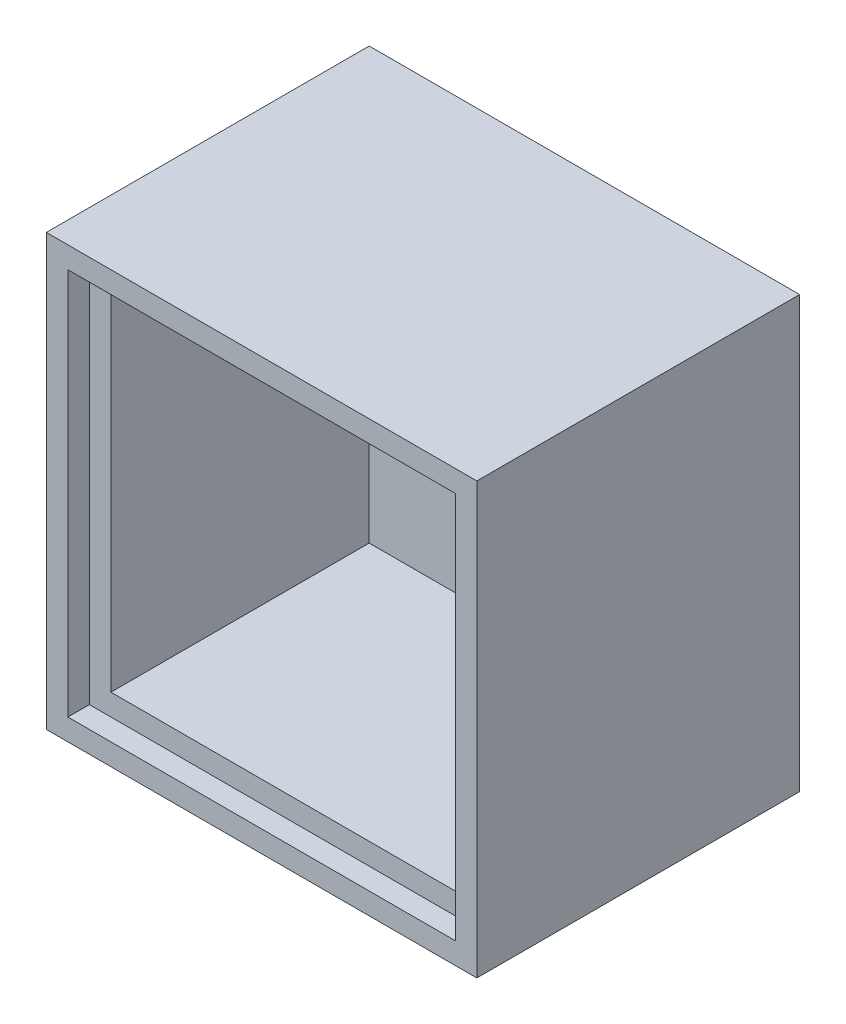
from build123d import *

# Parameters (mm, degrees)
SKETCH2_W           = 100
SKETCH2_H           = 100
BOSS_EXTRUDE1_DEPTH = 75
SHELL1_T            = -10
SKETCH3_W           = 90
SKETCH3_H           = 90
CUT_EXTRUDE1_DEPTH  = 5


with BuildPart() as part:
    # Sketch2 → Boss-Extrude1 (new body)
    with BuildSketch(Plane.XY):
        Rectangle(SKETCH2_W, SKETCH2_H)
    extrude(amount=BOSS_EXTRUDE1_DEPTH)

    # Shell1
    shell1_openings = [part.faces().sort_by_distance(p)[0] for p in [
        (0, 0, 75),
    ]]
    offset(amount=SHELL1_T, openings=shell1_openings, kind=Kind.INTERSECTION)

    # Sketch3 → Cut-Extrude1 (cut)
    with BuildSketch(Plane.XY.offset(75)):
        Rectangle(SKETCH3_W, SKETCH3_H)
    extrude(amount=-CUT_EXTRUDE1_DEPTH, mode=Mode.SUBTRACT)


solid = part.part
